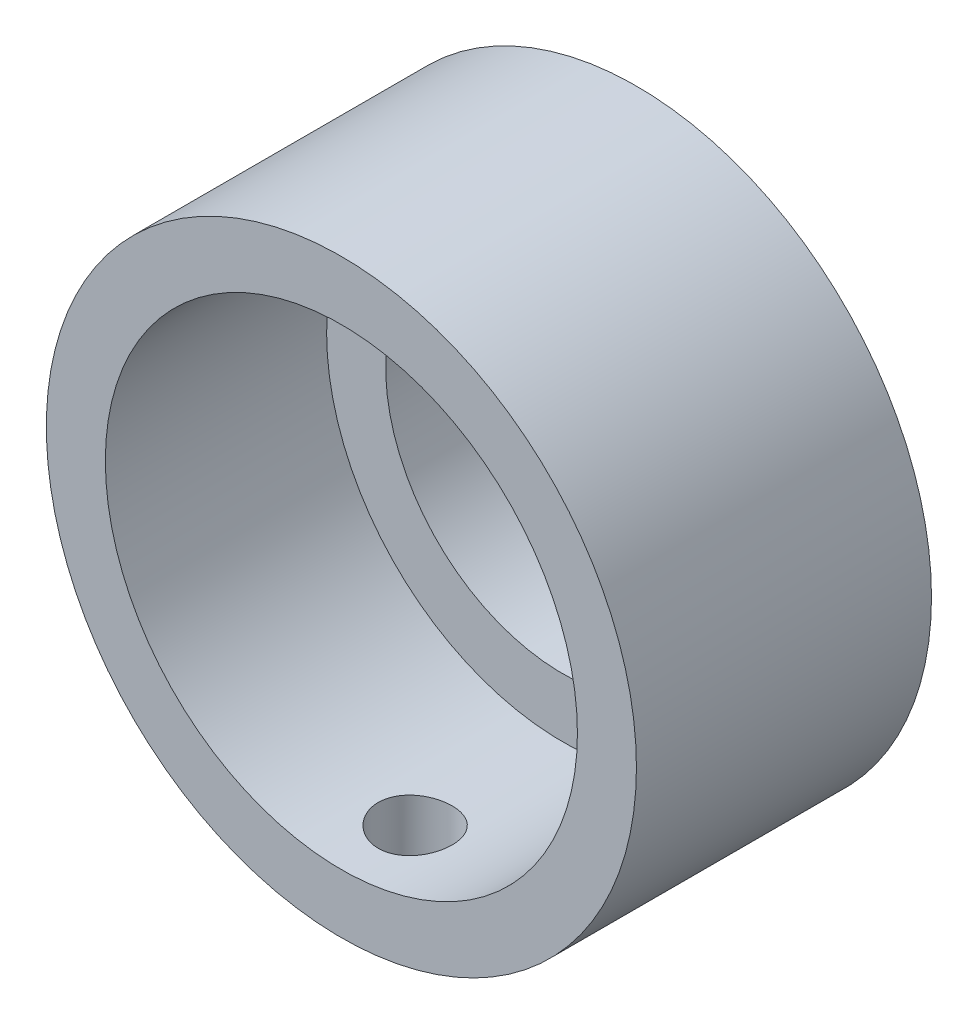
from build123d import *

# Parameters (mm, degrees)
SKETCH_3_R          = 0.5
CUT_EXTRUDE_1_DEPTH = 10


with BuildPart() as part:
    # 草图2 → 旋转1 (revolve)
    with BuildSketch(Plane(origin=(0, 0, 0), x_dir=(0, 0, -1), z_dir=(1, 0, 0)), mode=Mode.PRIVATE) as revolve_1_sk:
        Polygon((0, 3.2), (3, 3.2), (3, 2.4), (4, 2.4), (4, 4), (0, 4), align=None)
    revolve(revolve_1_sk.sketch.rotate(Axis((0, 0, 0), (0, 0, -1)), 90), axis=Axis((0, 0, 0), (0, 0, -1)))

    # 草图3 → 切除-拉伸1 (cut)
    with BuildSketch(Plane(origin=(0, 0, 0), x_dir=(1, 0, 0), z_dir=(0, 1, 0))):
        with Locations(Location((0, 1, 0), (0, 0, 270))):
            Circle(SKETCH_3_R)
    extrude(amount=-CUT_EXTRUDE_1_DEPTH, mode=Mode.SUBTRACT)


solid = part.part
